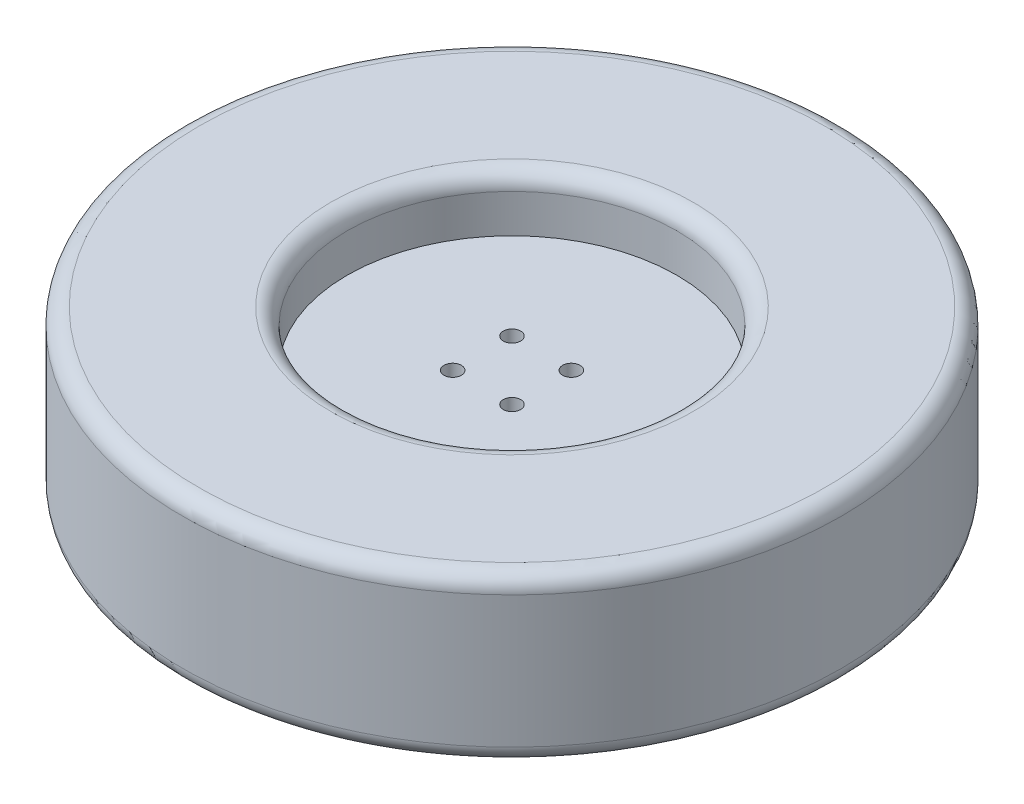
from build123d import *

# Parameters (mm, degrees)
WHEEL_EDGES_FILLET_R     = 3.81
SKETCH2_R                = 2.0066
F_4_MOUNTING_HOLES_DEPTH = 12.7


with BuildPart() as part:
    # Wheel Cross Section → Main Wheel Rev (revolve)
    with BuildSketch(Plane.XY):
        Polygon((0, 6.35), (0, -6.35), (-38.1, -6.35), (-38.1, -19.05), (-76.2, -19.05), (-76.2, 19.05), (-38.1, 19.05), (-38.1, 6.35), align=None)
    revolve(axis=Axis((0, 6.35, 0), (0, -1, 0)))

    # Wheel Edges Fillet
    wheel_edges_fillet_edges = [part.edges().sort_by_distance(p)[0] for p in [
        (38.1, 19.05, 0),
        (38.1, -19.05, 0),
        (76.2, -19.05, 0),
        (76.2, 19.05, 0),
    ]]
    fillet(wheel_edges_fillet_edges, radius=WHEEL_EDGES_FILLET_R)

    # Sketch2 → 4 Mounting Holes (cut)
    with BuildSketch(Plane(origin=(0, 6.35, 0), x_dir=(1, 0, 0), z_dir=(0, 1, 0))):
        with Locations(Location((-6.858, 6.858, 0), (0, 0, 180))):
            Circle(SKETCH2_R)
        with Locations(Location((6.858, 6.858, 0), (0, 0, 180))):
            Circle(SKETCH2_R)
        with Locations(Location((6.858, -6.858, 0), (0, 0, 180))):
            Circle(SKETCH2_R)
        with Locations(Location((-6.858, -6.858, 0), (0, 0, 180))):
            Circle(SKETCH2_R)
    extrude(amount=-F_4_MOUNTING_HOLES_DEPTH, mode=Mode.SUBTRACT)


solid = part.part
